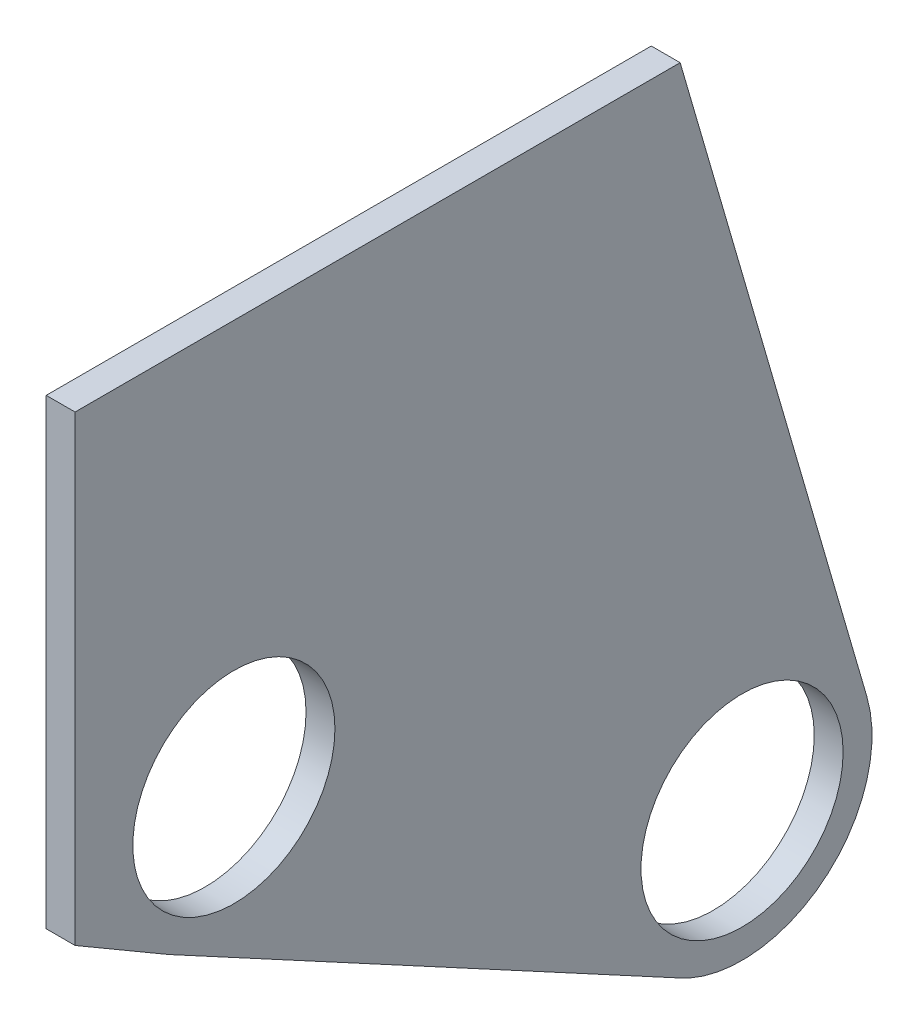
from build123d import *

# Parameters (mm, degrees)
SKETCH2_R           = 11.1125
BOSS_EXTRUDE1_DEPTH = 3.175


with BuildPart() as part:
    # Sketch2 → Boss-Extrude1 (new body)
    with BuildSketch(Plane(origin=(0, 0, 0), x_dir=(0, 0, -1), z_dir=(1, 0, 0))):
        with BuildLine():
            Line((13.719623131, 3.988056845), (-6.809679404, 74.6125))
            Line((-6.809679404, 74.6125), (-73.341598004, 74.6125))
            Line((-73.341598004, 74.6125), (-73.341598004, 23.8125))
            Line((-73.341598004, 23.8125), (-63.081952462, 17.823474758))
            Line((-63.081952462, 17.823474758), (-7.202854458, -12.339025242))
            ThreePointArc((-7.202854458, -12.339025242), (8.789793561, -11.263755386), (13.719623131, 3.988056845))
        make_face()
        with Locations((-55.879098004, 30.1625)):
            Circle(SKETCH2_R, mode=Mode.SUBTRACT)
        Circle(SKETCH2_R, mode=Mode.SUBTRACT)
    extrude(amount=BOSS_EXTRUDE1_DEPTH)


solid = part.part
